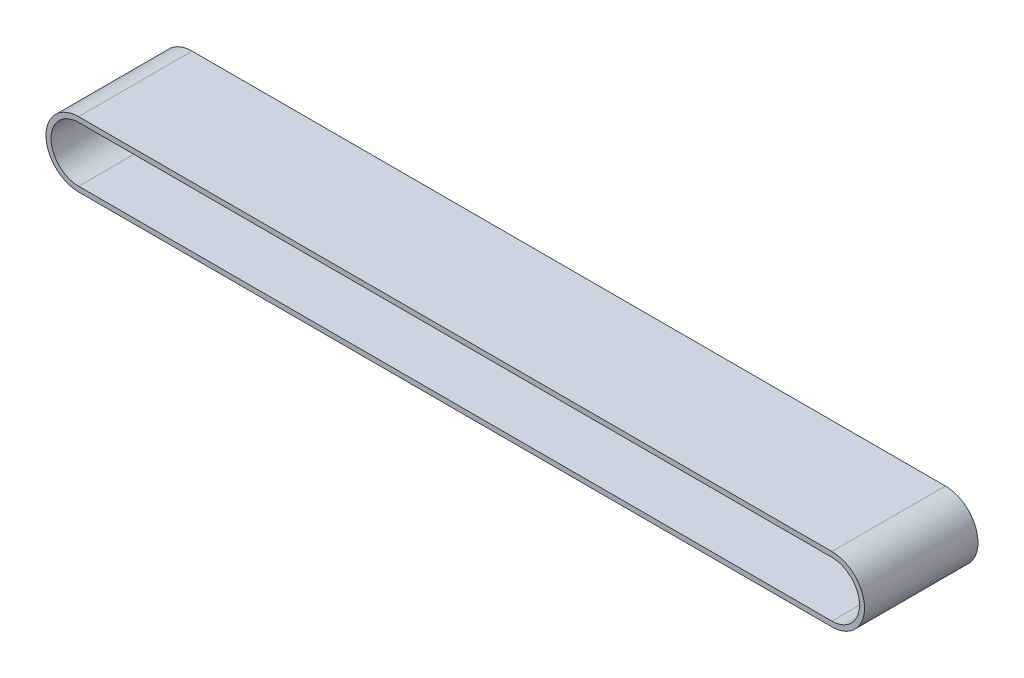
from build123d import *

# Parameters (mm, degrees)
BOSS_EXTRU_1_DEPTH = 113


with BuildPart() as part:
    # Esquisse1 → Boss.-Extru.1 (new body)
    with BuildSketch(Plane.XY):
        with BuildLine():
            Line((-375, 32.5), (375, 32.5))
            ThreePointArc((375, 32.5), (407.5, 0), (375, -32.5))
            Line((375, -32.5), (-375, -32.5))
            ThreePointArc((-375, -32.5), (-407.5, 0), (-375, 32.5))
        make_face()
        with BuildLine():
            Line((-375, 27.5), (375, 27.5))
            ThreePointArc((375, 27.5), (402.5, 0), (375, -27.5))
            Line((375, -27.5), (-375, -27.5))
            ThreePointArc((-375, -27.5), (-402.5, 0), (-375, 27.5))
        make_face(mode=Mode.SUBTRACT)
    extrude(amount=BOSS_EXTRU_1_DEPTH)


solid = part.part
